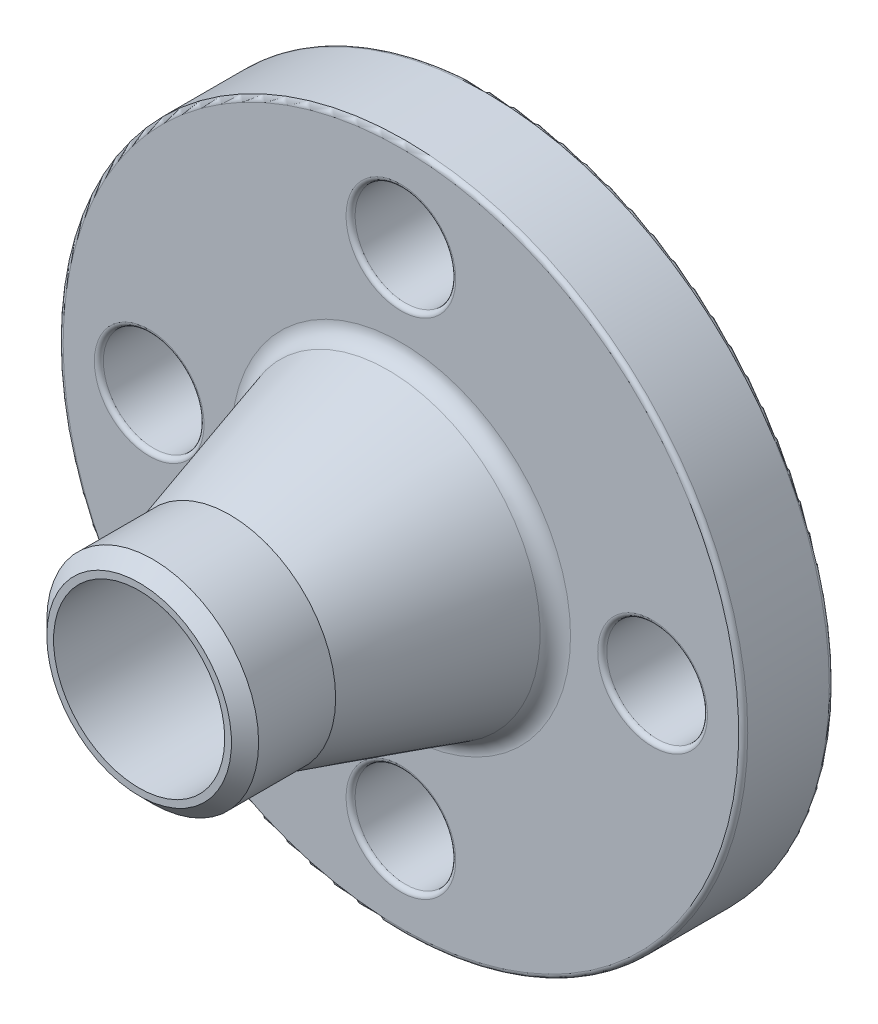
from build123d import *

# Parameters (mm, degrees)
SKETCH3_R          = 7.9375
CUT_EXTRUDE1_DEPTH = 87.776879841
CIRPATTERN1_COUNT  = 4
FILLET1_R          = 2.8575
CHAMFER1_SIZE      = 2.143125
FILLET2_R          = 0.714375


with BuildPart() as part:
    # Sketch2 → Revolve1 (revolve)
    with BuildSketch(Plane(origin=(0, 0, 0), x_dir=(0, 0, -1), z_dir=(1, 0, 0)), mode=Mode.PRIVATE) as revolve1_sk:
        Polygon((-27.78125, 16.7005), (-27.78125, 13.49375), (27.78125, 13.49375), (27.78125, 53.975), (13.49375, 53.975), (13.49375, 24.60625), (-13.49375, 16.7005), align=None)
    revolve(revolve1_sk.sketch.rotate(Axis((0, 0, 27.78125), (0, 0, -1)), 90), axis=Axis((0, 0, 27.78125), (0, 0, -1)))

    # Sketch3 → Cut-Extrude1 (cut, through all)
    with BuildSketch(Plane.XY.offset(-13.49375)):
        with Locations((0, 39.6875)):
            Circle(SKETCH3_R)
    cut_extrude1 = extrude(amount=-CUT_EXTRUDE1_DEPTH, mode=Mode.SUBTRACT)

    # CirPattern1: Cut-Extrude1 ×4 about axis
    cirpattern1_axis = Axis((0, 0, 0), (0, 0, 1))
    for i in range(1, CIRPATTERN1_COUNT):
        add(cut_extrude1.rotate(cirpattern1_axis, i * 360 / CIRPATTERN1_COUNT), mode=Mode.SUBTRACT)

    # Fillet1
    fillet1_edges = [part.edges().sort_by_distance(p)[0] for p in [
        (-24.60625, 0, -13.49375),
    ]]
    fillet(fillet1_edges, radius=FILLET1_R)

    # Chamfer1
    chamfer1_edges = [part.edges().sort_by_distance(p)[0] for p in [
        (-16.7005, 0, 27.78125),
    ]]
    chamfer(chamfer1_edges, length=CHAMFER1_SIZE)

    # Fillet2
    fillet2_edges = [part.edges().sort_by_distance(p)[0] for p in [
        (-7.9375, 39.6875, -27.78125),
        (-7.9375, 39.6875, -13.49375),
        (39.6875, 7.9375, -27.78125),
        (39.6875, 7.9375, -13.49375),
        (7.9375, -39.6875, -27.78125),
        (7.9375, -39.6875, -13.49375),
        (-39.6875, -7.9375, -27.78125),
        (-39.6875, -7.9375, -13.49375),
        (-53.975, 0, -13.49375),
        (-53.975, 0, -27.78125),
        (-13.49375, 0, -27.78125),
    ]]
    fillet(fillet2_edges, radius=FILLET2_R)


solid = part.part
